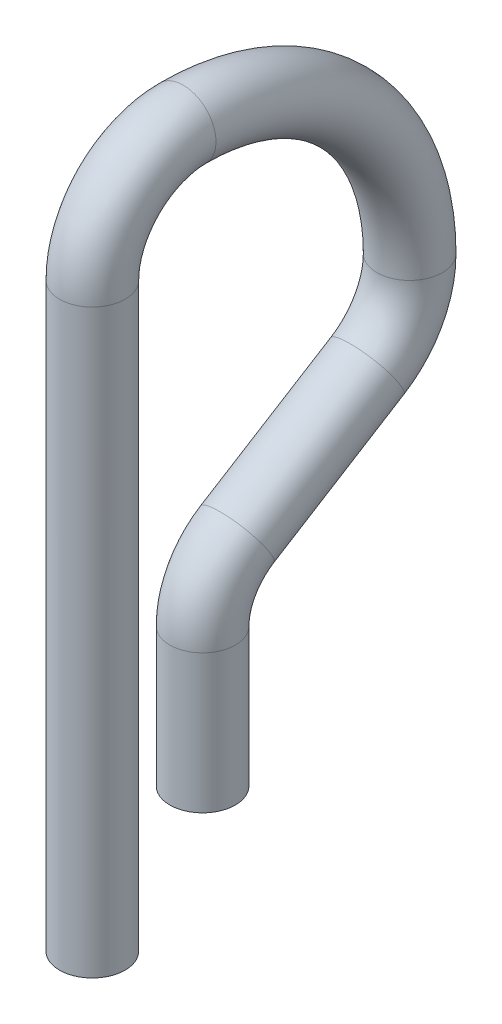
from build123d import *

# Parameters (mm, degrees)
SWEEP1_PROFILE_R = 5.588


with BuildPart() as part:
    # Sweep1: sweep along a path in Sketch1
    with BuildLine(Plane.YZ) as sweep1_path:
        Line((0, 0), (99.06, 0))
        ThreePointArc((99.06, 0), (110.015912468, -4.538087532), (114.554, -15.494))
        ThreePointArc((114.554, -15.494), (103.245978608, -42.793978608), (75.946, -54.102))
        ThreePointArc((75.946, -54.102), (68.532892782, -52.177533837), (62.992, -46.89016816))
        Line((62.992, -46.89016816), (49.253947791, -24.72287859))
        ThreePointArc((49.253947791, -24.72287859), (44.700292142, -20.377578377), (38.608, -18.796))
        Line((38.608, -18.796), (14.986, -18.796))
    # Sweep1 profile (on start of the path) → Sweep1 (sweep)
    with BuildSketch(Plane.ZX):
        Circle(SWEEP1_PROFILE_R)
    sweep(path=sweep1_path.line)


solid = part.part
